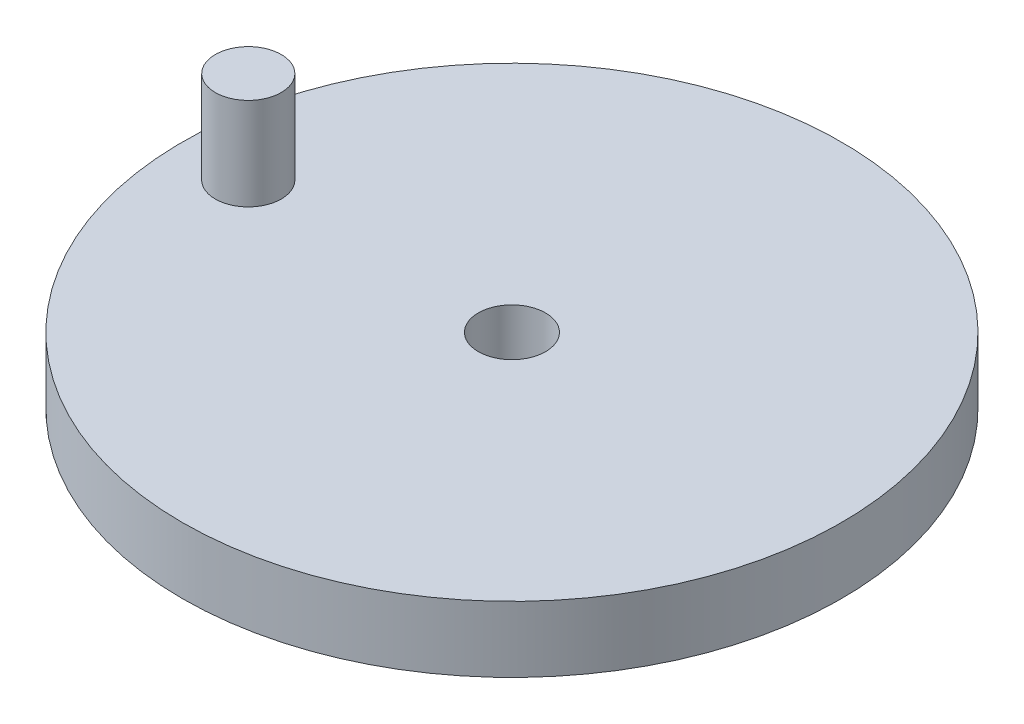
from build123d import *

# Parameters (mm, degrees)
SKETCH_1_R      = 25
SKETCH_1_R_2    = 2.55
EXTRUDE_1_DEPTH = 5
SKETCH_2_R      = 2.5
EXTRUDE_2_DEPTH = 7


with BuildPart() as part:
    # 草圖1 → 填料-伸長1 (new body)
    with BuildSketch(Plane(origin=(0, 0, 0), x_dir=(1, 0, 0), z_dir=(0, 1, 0))):
        with Locations(Location((0, 0, 0), (0, 0, 270))):
            Circle(SKETCH_1_R)
        with Locations(Location((0, 0, 0), (0, 0, 270))):
            Circle(SKETCH_1_R_2, mode=Mode.SUBTRACT)
    extrude(amount=EXTRUDE_1_DEPTH)

    # 草圖2 → 填料-伸長2 (add)
    with BuildSketch(Plane(origin=(0, 5, 0), x_dir=(1, 0, 0), z_dir=(0, 1, 0))):
        with Locations(Location((-20, 0, 0), (0, 0, 270))):
            Circle(SKETCH_2_R)
    extrude(amount=EXTRUDE_2_DEPTH)


solid = part.part
